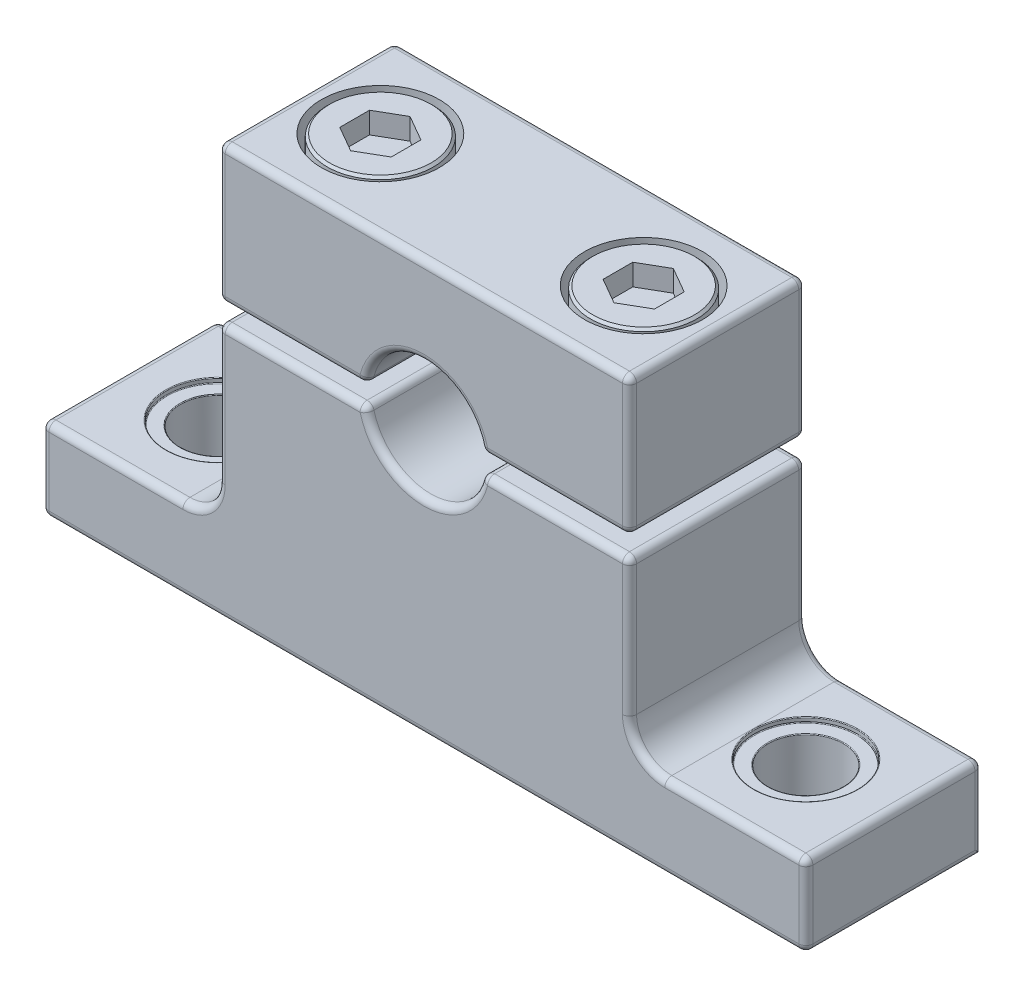
from build123d import *

# Parameters (mm, degrees)
BOSS_EXTRUDE1_DEPTH   = 9.525
BOSS_EXTRUDE1_2_DEPTH = 9.525
SKETCH4_R             = 2.032
CUT_EXTRUDE1_DEPTH    = 32.789662726
SKETCH8_R             = 2.794
CUT_EXTRUDE3_DEPTH    = 9.5885
SKETCH10_R            = 2.0066
CUT_EXTRUDE4_DEPTH    = 32.789662726
SKETCH12_R            = 3.1877
CUT_EXTRUDE5_DEPTH    = 3.8862
CHAMFER1_SIZE         = 0.127
CUT_EXTRUDE6_DEPTH    = 1.156716
FILLET1_R             = 0.381
FILLET2_R             = 0.381
FILLET3_R             = 0.0381


with BuildPart() as part:
    # Sketch3 → Boss-Extrude1 (new body)
    with BuildSketch(Plane.XY):
        with BuildLine():
            Line((-11.1125, 22.225), (11.1125, 22.225))
            Line((11.1125, 22.225), (11.1125, 14.7955))
            Line((11.1125, 14.7955), (3.134096521, 14.7955))
            ThreePointArc((3.134096521, 14.7955), (0, 17.4625), (-3.134096521, 14.7955))
            Line((-3.134096521, 14.7955), (-11.1125, 14.7955))
            Line((-11.1125, 14.7955), (-11.1125, 22.225))
        make_face()
    extrude(amount=-BOSS_EXTRUDE1_DEPTH)


with BuildPart() as body_2:
    # Sketch3 → Boss-Extrude1 2 (new body)
    with BuildSketch(Plane.XY):
        with BuildLine():
            Line((-11.1125, 13.7795), (-11.1125, 6.35))
            ThreePointArc((-11.1125, 6.35), (-11.670461582, 5.002961582), (-13.0175, 4.445))
            Line((-13.0175, 4.445), (-20.6375, 4.445))
            Line((-20.6375, 4.445), (-20.6375, 0))
            Line((-20.6375, 0), (20.6375, 0))
            Line((20.6375, 0), (20.6375, 4.445))
            Line((20.6375, 4.445), (13.0175, 4.445))
            ThreePointArc((13.0175, 4.445), (11.670461582, 5.002961582), (11.1125, 6.35))
            Line((11.1125, 6.35), (11.1125, 13.7795))
            Line((11.1125, 13.7795), (3.134096521, 13.7795))
            ThreePointArc((3.134096521, 13.7795), (0, 11.1125), (-3.134096521, 13.7795))
            Line((-3.134096521, 13.7795), (-11.1125, 13.7795))
        make_face()
    extrude(amount=-BOSS_EXTRUDE1_2_DEPTH)

    # Sketch4 → Cut-Extrude1 (cut, through all)
    with BuildSketch(Plane.XZ):
        with Locations((-15.875, -4.7625)):
            Circle(SKETCH4_R)
        with Locations(Location((15.875, -4.7625, 0), (0, 0, 180))):
            Circle(SKETCH4_R)
    extrude(amount=-CUT_EXTRUDE1_DEPTH, mode=Mode.SUBTRACT)

    # Sketch8 → Cut-Extrude3 (cut)
    with BuildSketch(Plane(origin=(0, 13.7795, 0), x_dir=(1, 0, 0), z_dir=(0, 1, 0))):
        with Locations(Location((-15.875, 4.7625, 0), (0, 0, 180))):
            Circle(SKETCH8_R)
        with Locations(Location((15.875, 4.7625, 0), (0, 0, 180))):
            Circle(SKETCH8_R)
    extrude(amount=-CUT_EXTRUDE3_DEPTH, mode=Mode.SUBTRACT)


with BuildPart() as cut_extrude4_tool:
    # Sketch10 → Cut-Extrude4 (new, through all)
    with BuildSketch(Plane(origin=(0, 22.225, 0), x_dir=(1, 0, 0), z_dir=(0, 1, 0))):
        with Locations(Location((7.112, 4.7625, 0), (0, 0, 180))):
            Circle(SKETCH10_R)
        with Locations(Location((-7.112, 4.7625, 0), (0, 0, 180))):
            Circle(SKETCH10_R)
    extrude(amount=-CUT_EXTRUDE4_DEPTH)


with BuildPart() as part_1:
    add(part.part)

    # Cut-Extrude4: cut by cut_extrude4_tool
    add(cut_extrude4_tool.part, mode=Mode.SUBTRACT)

    # Sketch12 → Cut-Extrude5 (cut)
    with BuildSketch(Plane(origin=(0, 22.225, 0), x_dir=(1, 0, 0), z_dir=(0, 1, 0))):
        with Locations(Location((7.112, 4.7625, 0), (0, 0, 180))):
            Circle(SKETCH12_R)
        with Locations(Location((-7.112, 4.7625, 0), (0, 0, 180))):
            Circle(SKETCH12_R)
    extrude(amount=-CUT_EXTRUDE5_DEPTH, mode=Mode.SUBTRACT)

    # Fillet1
    fillet1_edges = [part_1.edges().sort_by_distance(p)[0] for p in [
        (0, 17.4625, -9.525),
        (-11.1125, 22.225, -4.7625),
        (11.1125, 22.225, -4.7625),
        (11.1125, 14.7955, -4.7625),
        (3.134096521, 14.7955, -4.7625),
        (-3.134096521, 14.7955, -4.7625),
        (-11.1125, 14.7955, -4.7625),
        (7.12329826, 14.7955, -9.525),
        (11.1125, 18.51025, -9.525),
        (0, 22.225, -9.525),
        (-11.1125, 18.51025, -9.525),
        (0, 22.225, 0),
        (11.1125, 18.51025, 0),
        (7.12329826, 14.7955, 0),
        (-7.12329826, 14.7955, -9.525),
        (0, 17.4625, 0),
        (-7.12329826, 14.7955, 0),
        (-11.1125, 18.51025, 0),
    ]]
    fillet(fillet1_edges, radius=FILLET1_R)


with BuildPart() as body_2_1:
    add(body_2.part)

    # Cut-Extrude4: cut by cut_extrude4_tool
    add(cut_extrude4_tool.part, mode=Mode.SUBTRACT)

    # Fillet2
    fillet2_edges = [body_2_1.edges().sort_by_distance(p)[0] for p in [
        (-11.670461582, 5.002961582, -9.525),
        (0, 11.1125, 0),
        (7.12329826, 13.7795, 0),
        (11.1125, 10.06475, 0),
        (11.670461582, 5.002961582, 0),
        (16.8275, 4.445, 0),
        (20.6375, 2.2225, 0),
        (-16.8275, 4.445, -9.525),
        (0, 0, 0),
        (-20.6375, 2.2225, 0),
        (-16.8275, 4.445, 0),
        (-11.670461582, 5.002961582, 0),
        (-11.1125, 10.06475, 0),
        (-7.12329826, 13.7795, 0),
        (-20.6375, 2.2225, -9.525),
        (-3.134096521, 13.7795, -4.7625),
        (3.134096521, 13.7795, -4.7625),
        (11.1125, 13.7795, -4.7625),
        (20.6375, 4.445, -4.7625),
        (20.6375, 0, -4.7625),
        (-20.6375, 0, -4.7625),
        (-20.6375, 4.445, -4.7625),
        (-11.1125, 13.7795, -4.7625),
        (20.6375, 2.2225, -9.525),
        (16.8275, 4.445, -9.525),
        (11.670461582, 5.002961582, -9.525),
        (11.1125, 10.06475, -9.525),
        (7.12329826, 13.7795, -9.525),
        (0, 11.1125, -9.525),
        (-7.12329826, 13.7795, -9.525),
        (-11.1125, 10.06475, -9.525),
    ]]
    fillet(fillet2_edges, radius=FILLET2_R)

    # Fillet3
    fillet3_edges = [body_2_1.edges().sort_by_distance(p)[0] for p in [
        (-13.081, 4.445, -4.7625),
        (-13.081, 4.191, -4.7625),
        (-17.907, 4.191, -4.7625),
        (18.669, 4.445, -4.7625),
        (17.907, 4.191, -4.7625),
        (18.669, 4.191, -4.7625),
    ]]
    fillet(fillet3_edges, radius=FILLET3_R)


with BuildPart() as body_3:
    # Sketch15 → Revolve1 (revolve)
    with BuildSketch(Plane.XY.offset(-4.7625), mode=Mode.PRIVATE) as revolve1_sk:
        Polygon((-7.112, 8.89), (-7.112, 22.225), (-9.9822, 22.225), (-9.9822, 18.7198), (-8.8646, 18.7198), (-8.8646, 8.89), align=None)
    revolve(revolve1_sk.sketch.rotate(Axis((-7.112, 8.89, -4.7625), (0, 1, 0)), 270), axis=Axis((-7.112, 8.89, -4.7625), (0, 1, 0)))

    # Chamfer1
    chamfer1_edges = [body_3.edges().sort_by_distance(p)[0] for p in [
        (-7.112, 22.225, -1.8923),
    ]]
    chamfer(chamfer1_edges, length=CHAMFER1_SIZE)

    # Sketch16 → Cut-Extrude6 (cut)
    with BuildSketch(Plane(origin=(0, 22.225, 0), x_dir=(1, 0, 0), z_dir=(0, 1, 0))):
        Polygon((-7.112, 6.366451217), (-8.5010625, 5.564475608), (-8.5010625, 3.960524392), (-7.112, 3.158548783), (-5.7229375, 3.960524392), (-5.7229375, 5.564475608), align=None)
    extrude(amount=-CUT_EXTRUDE6_DEPTH, mode=Mode.SUBTRACT)


with BuildPart() as body_4:
    # Mirror1: mirrored copy
    add(body_3.part.mirror(Plane(origin=(0, 0, 0), x_dir=(0, 0, 1), z_dir=(1, 0, 0))))


solid = Compound([part_1.part, body_2_1.part, body_3.part, body_4.part])
